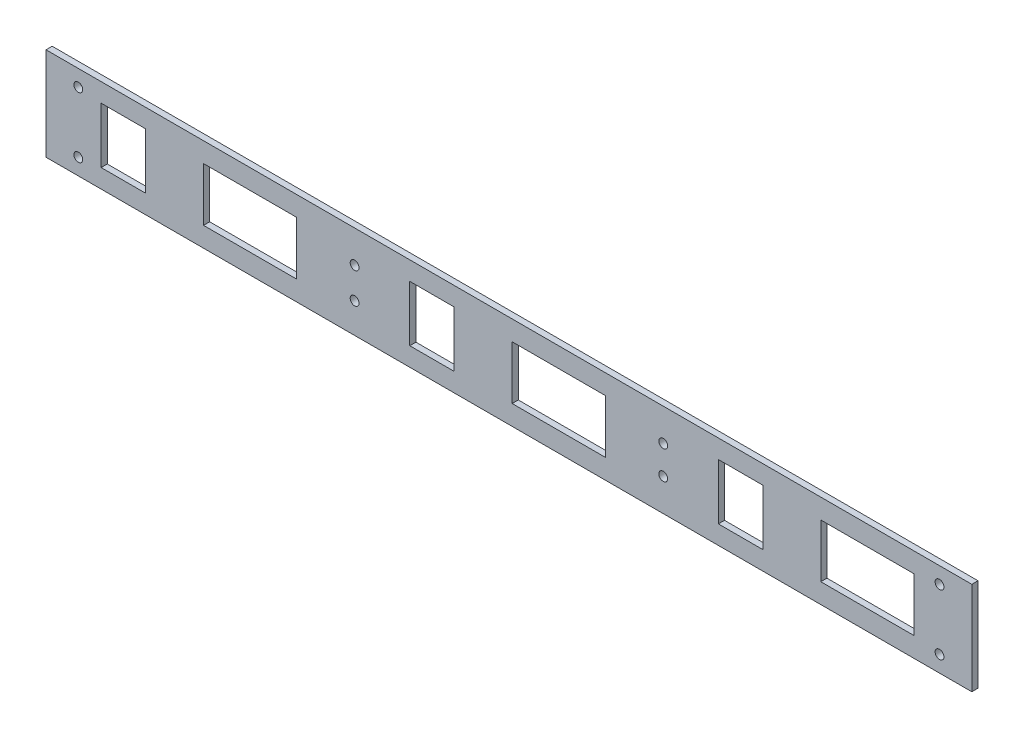
from build123d import *

# Parameters (mm, degrees)
SKETCH_1_W          = 450
SKETCH_1_H          = 45.25
EXTRUDE_1_DEPTH     = 3
SKETCH_1_3_W        = 21.6
SKETCH_1_3_H        = 27.1
SKETCH_1_3_W_2      = 45.25
SKETCH_1_3_H_2      = 26
CUT_EXTRUDE_2_DEPTH = 3
SKETCH_2_R          = 2.15
CUT_EXTRUDE_3_DEPTH = 5
SKETCH_3_R          = 2.15
CUT_EXTRUDE_4_DEPTH = 5


with BuildPart() as part:
    # 草圖1 → 填料-伸長1 (new body)
    with BuildSketch(Plane.XY):
        with Locations((150, 0)):
            Rectangle(SKETCH_1_W, SKETCH_1_H)
    extrude(amount=EXTRUDE_1_DEPTH)

    # 草圖1<3> → 除料-伸長2 (cut)
    with BuildSketch(Plane.XY):
        with Locations((-37.4, 0)):
            Rectangle(SKETCH_1_3_W, SKETCH_1_3_H)
        with Locations((174.2, 0)):
            Rectangle(SKETCH_1_3_W_2, SKETCH_1_3_H_2)
        with Locations((24.2, 0)):
            Rectangle(SKETCH_1_3_W_2, SKETCH_1_3_H_2)
        with Locations((112.6, 0)):
            Rectangle(SKETCH_1_3_W, SKETCH_1_3_H)
        with Locations((324.2, 0)):
            Rectangle(SKETCH_1_3_W_2, SKETCH_1_3_H_2)
        with Locations((262.6, 0)):
            Rectangle(SKETCH_1_3_W, SKETCH_1_3_H)
    extrude(amount=CUT_EXTRUDE_2_DEPTH, mode=Mode.SUBTRACT)

    # 草圖2 → 除料-伸長3 (cut)
    with BuildSketch(Plane(origin=(0, 0, 0), x_dir=(-1, 0, 0), z_dir=(0, 0, -1))):
        with Locations((-359.3, 14.725)):
            Circle(SKETCH_2_R)
        with Locations((-359.3, -14.725)):
            Circle(SKETCH_2_R)
        with Locations((59.3, 14.725)):
            Circle(SKETCH_2_R)
        with Locations((59.3, -14.725)):
            Circle(SKETCH_2_R)
    extrude(amount=-CUT_EXTRUDE_3_DEPTH, mode=Mode.SUBTRACT)

    # 草圖3 → 除料-伸長4 (cut)
    with BuildSketch(Plane(origin=(0, 0, 0), x_dir=(-1, 0, 0), z_dir=(0, 0, -1))):
        with Locations((-225.014075293, 6.925)):
            Circle(SKETCH_3_R)
        with Locations((-225, -6.925)):
            Circle(SKETCH_3_R)
        with Locations((-75.000000001, 6.925)):
            Circle(SKETCH_3_R)
        with Locations((-75, -8.025)):
            Circle(SKETCH_3_R)
    extrude(amount=-CUT_EXTRUDE_4_DEPTH, mode=Mode.SUBTRACT)


solid = part.part
